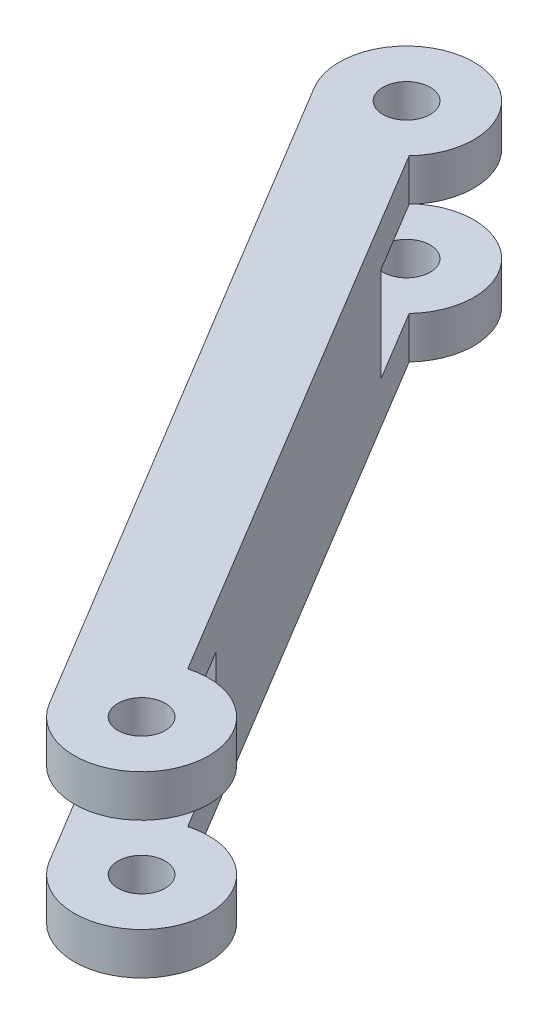
from build123d import *

# Parameters (mm, degrees)
SKETCH1_R           = 1.125
BOSS_EXTRUDE8_DEPTH = 8.5
SKETCH7_W           = 21.266336275
SKETCH7_H           = 4.5
SKETCH7_W_2         = 16.445168877
CUT_EXTRUDE4_DEPTH  = 8.5


with BuildPart() as part:
    # Sketch1 → Boss-Extrude8 (new body)
    with BuildSketch(Plane(origin=(0, 0, 0), x_dir=(1, 0, 0), z_dir=(0, 1, 0))):
        with BuildLine():
            Line((-20.409504298, 38.12712418), (-1.324999325, 6.430835597))
            ThreePointArc((-1.324999325, 6.430835597), (4.394124385, 6.909573649), (0.535312803, 11.157766123))
            Line((0.535312803, 11.157766123), (-15.345836995, 37.576115954))
            ThreePointArc((-15.345836995, 37.576115954), (-17.321908656, 42.958973619), (-20.409504298, 38.12712418))
        make_face()
        with Locations(Location((-17.668076542, 39.777752502, 0), (0, 0, 270))):
            Circle(SKETCH1_R, mode=Mode.SUBTRACT)
        with Locations(Location((1.416428431, 8.08146392, 0), (0, 0, 270))):
            Circle(SKETCH1_R, mode=Mode.SUBTRACT)
    extrude(amount=BOSS_EXTRUDE8_DEPTH)

    # Sketch7 → Cut-Extrude4 (cut)
    with BuildSketch(Plane(origin=(1.869345706, 0, -1.125543053), x_dir=(0.5158213506967773, 0, 0.8566961737777006), z_dir=(-0.8566961737777007, 0, 0.5158213506967774))):
        with Locations((-46.824187614, 4.25)):
            Rectangle(SKETCH7_W, SKETCH7_H)
        with Locations((-4.970150754, 4.25)):
            Rectangle(SKETCH7_W_2, SKETCH7_H)
    extrude(amount=-CUT_EXTRUDE4_DEPTH, mode=Mode.SUBTRACT)


solid = part.part
